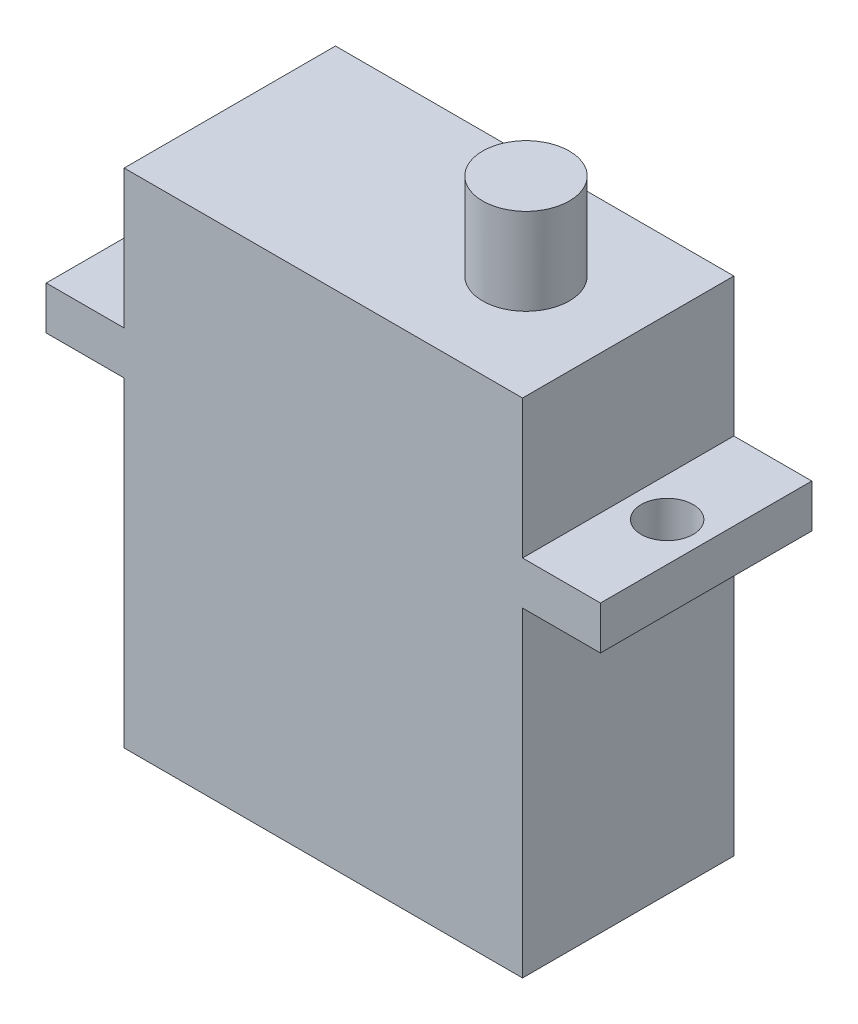
from build123d import *

# Parameters (mm, degrees)
SKETCH_1_W          = 23
SKETCH_1_H          = 12.2
EXTRUDE_1_DEPTH     = 29
SKETCH_2_W          = 32
SKETCH_2_H          = 2.5
EXTRUDE_2_DEPTH     = 12.2
SKETCH_3_R          = 1.5
CUT_EXTRUDE_1_DEPTH = 6
SKETCH_4_R          = 2.5
EXTRUDE_3_DEPTH     = 5


with BuildPart() as part:
    # Эскиз1 → Бобышка-Вытянуть1 (new body)
    with BuildSketch(Plane(origin=(0, 0, 0), x_dir=(1, 0, 0), z_dir=(0, 1, 0))):
        Rectangle(SKETCH_1_W, SKETCH_1_H)
    extrude(amount=EXTRUDE_1_DEPTH)

    # Эскиз2 → Бобышка-Вытянуть2 (add)
    with BuildSketch(Plane(origin=(0, 0, -6.1), x_dir=(-1, 0, 0), z_dir=(0, 0, -1))):
        with Locations((0, 19.75)):
            Rectangle(SKETCH_2_W, SKETCH_2_H)
    extrude(amount=-EXTRUDE_2_DEPTH)

    # Эскиз3 → Вырез-Вытянуть1 (cut)
    with BuildSketch(Plane(origin=(0, 21, 0), x_dir=(1, 0, 0), z_dir=(0, 1, 0))):
        with Locations(Location((13.75, 0, 0), (0, 0, 270))):
            Circle(SKETCH_3_R)
        with Locations(Location((-13.75, 0, 0), (0, 0, 90))):
            Circle(SKETCH_3_R)
    extrude(amount=-CUT_EXTRUDE_1_DEPTH, mode=Mode.SUBTRACT)

    # Эскиз4 → Бобышка-Вытянуть3 (add)
    with BuildSketch(Plane(origin=(0, 29, 0), x_dir=(1, 0, 0), z_dir=(0, 1, 0))):
        with Locations(Location((5.5, 0.1, 0), (0, 0, 90))):
            Circle(SKETCH_4_R)
    extrude(amount=EXTRUDE_3_DEPTH)


solid = part.part
